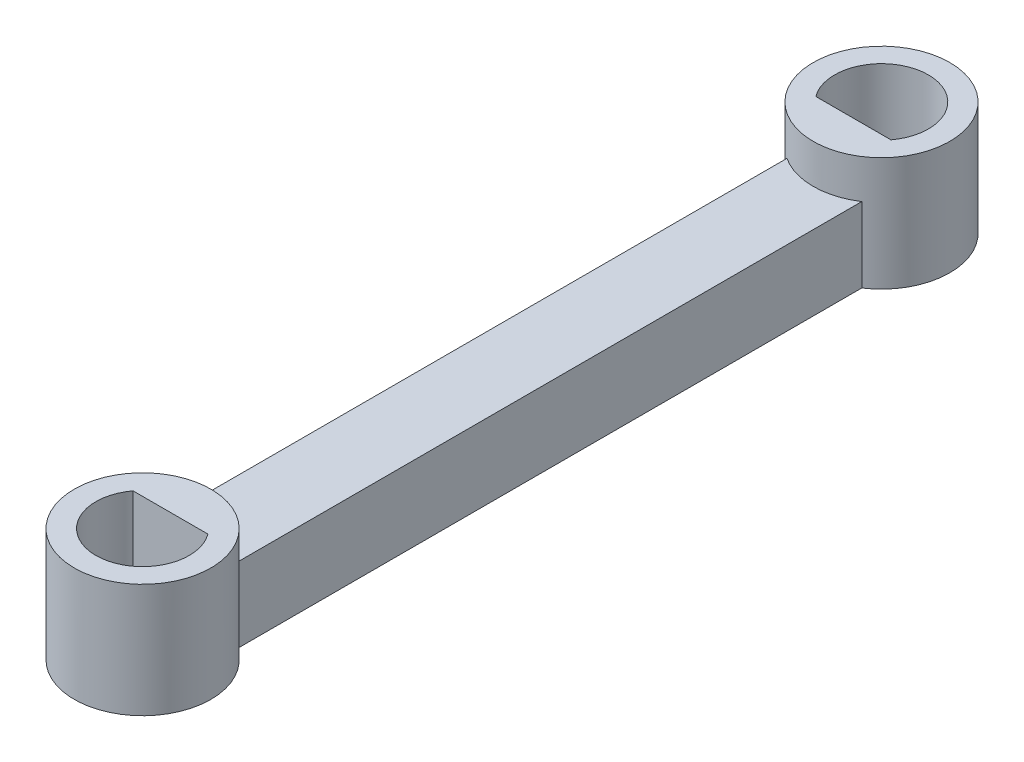
from build123d import *

# Parameters (mm, degrees)
SKETCH1_R           = 6
BOSS_EXTRUDE1_DEPTH = 10
SKETCH2_W           = 6.574952472
SKETCH2_H           = 6.574952471
BOSS_EXTRUDE2_DEPTH = 60
CUT_EXTRUDE1_DEPTH  = 72.85269654


with BuildPart() as part:
    # Sketch1 → Boss-Extrude1 (new body)
    with BuildSketch(Plane(origin=(0, 0, 0), x_dir=(1, 0, 0), z_dir=(0, 1, 0))):
        with Locations(Location((0, 0, 0), (0, 0, 270))):
            Circle(SKETCH1_R)
        with BuildLine():
            Line((-3.287476236, 2.45), (3.287476236, 2.45))
            ThreePointArc((3.287476236, 2.45), (0, -4.1), (-3.287476236, 2.45))
        make_face(mode=Mode.SUBTRACT)
    boss_extrude1 = extrude(amount=BOSS_EXTRUDE1_DEPTH)

    # Sketch2 → Boss-Extrude2 (add)
    with BuildSketch(Plane.XY.offset(-2.45)):
        with Locations((0, 3.287476236)):
            Rectangle(SKETCH2_W, SKETCH2_H)
    extrude(amount=-BOSS_EXTRUDE2_DEPTH)

    # Mirror1: Boss-Extrude1 across plane
    add(boss_extrude1.mirror(Plane(origin=(0, 0, -32.45), x_dir=(1, 0, 0), z_dir=(0, 0, -1))))

    # Sketch3 → Cut-Extrude1 (cut, through all)
    with BuildSketch(Plane(origin=(0, 10, 0), x_dir=(1, 0, 0), z_dir=(0, 1, 0))):
        with BuildLine():
            Line((-3.297499052, 62.43), (3.297499052, 62.43))
            ThreePointArc((3.297499052, 62.43), (0, 69.02), (-3.297499052, 62.43))
        make_face()
    extrude(amount=-CUT_EXTRUDE1_DEPTH, mode=Mode.SUBTRACT)


solid = part.part
